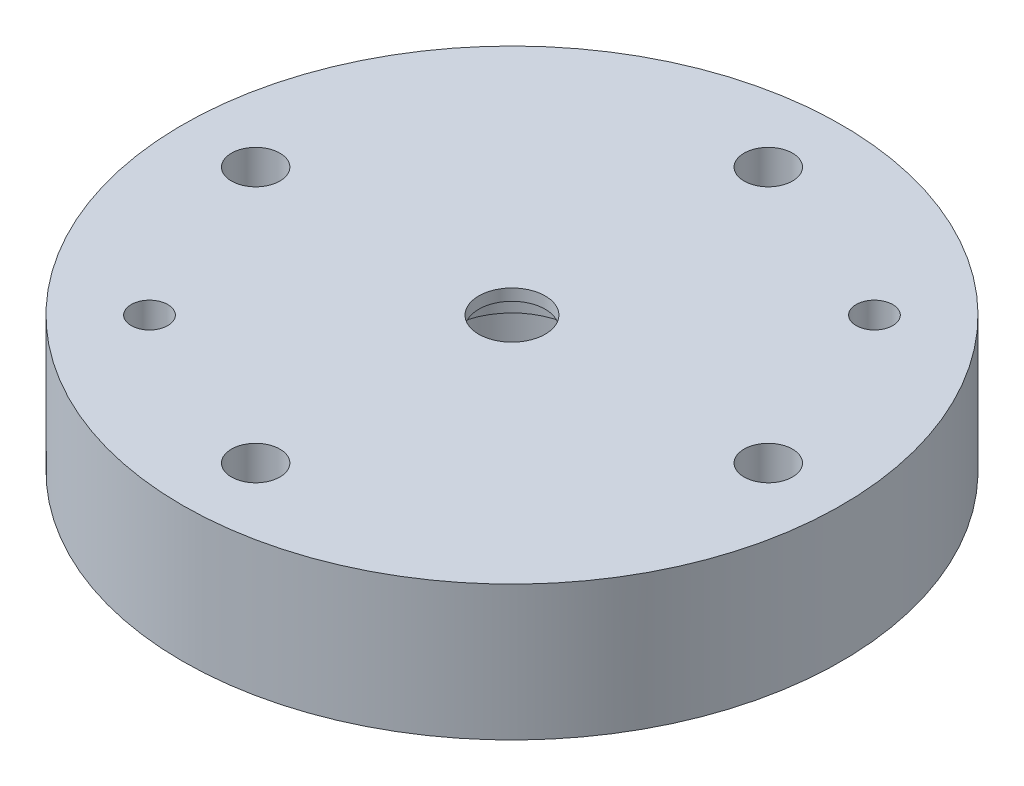
from build123d import *

# Parameters (mm, degrees)
SKETCH1_R                      = 57.15
SEAL_SEAT_HIEGHT_DEPTH         = 5.5372
SKETCH2_R                      = 57.15
SEAL_DIAPHRAM_HIEGHT_DEPTH     = 15.875
SEAL_START                     = 2
SKETCH3_R                      = 57.15
SEAL_SHOULDER_HIEGHT_DEPTH     = 2
SKETCH5_R                      = 11.1125
SEAL_SEAT_FIT_DEPTH            = 5.5372
SKETCH7_R                      = 5.7625
SHAFT_CLEARANCE_DEPTH          = 2
M8_CLEARANCE_HOLE1_D           = 8.4
F_1_4_0_25_PRESS_DOWEL_HOLE1_D = 6.35
SKETCH6_R                      = 12.7
CUT_EXTRUDE1_DEPTH             = 15.875


with BuildPart() as part:
    # Sketch1 → seal seat hieght (new body)
    with BuildSketch(Plane(origin=(0, 0, 0), x_dir=(1, 0, 0), z_dir=(0, 1, 0))):
        with Locations(Location((0, 0, 0), (0, 0, 270))):
            Circle(SKETCH1_R)
    extrude(amount=-SEAL_SEAT_HIEGHT_DEPTH)

    # Sketch2 → seal diaphram hieght (add)
    with BuildSketch(Plane.XZ.offset(5.5372)):
        with Locations(Location((0, 0, 0), (0, 0, 90))):
            Circle(SKETCH2_R)
    extrude(amount=SEAL_DIAPHRAM_HIEGHT_DEPTH)

    # Sketch3 → seal shoulder hieght (add)
    with BuildSketch(Plane(origin=(0, 0, 0), x_dir=(1, 0, 0), z_dir=(0, 1, 0)).offset(SEAL_START)):
        with Locations(Location((0, 0, 0), (0, 0, 270))):
            Circle(SKETCH3_R)
    extrude(amount=-SEAL_SHOULDER_HIEGHT_DEPTH)

    # Sketch5 → seal seat fit (cut)
    with BuildSketch(Plane(origin=(0, 0, 0), x_dir=(1, 0, 0), z_dir=(0, 1, 0))):
        with Locations(Location((0, 0, 0), (0, 0, 270))):
            Circle(SKETCH5_R)
    extrude(amount=-SEAL_SEAT_FIT_DEPTH, mode=Mode.SUBTRACT)

    # Sketch7 → shaft clearance (cut)
    with BuildSketch(Plane(origin=(0, 0, 0), x_dir=(1, 0, 0), z_dir=(0, 1, 0))):
        with Locations(Location((0, 0, 0), (0, 0, 270))):
            Circle(SKETCH7_R)
    extrude(amount=SHAFT_CLEARANCE_DEPTH, mode=Mode.SUBTRACT)

    # M8 Clearance Hole1 (through all)
    with Locations(Plane(origin=(0, 2, 0), x_dir=(1, 0, 0), z_dir=(0, 1, 0))):
        with Locations((-44.45, 0), (0, 44.45), (44.45, 0), (0, -44.45)):
            Hole(M8_CLEARANCE_HOLE1_D / 2)

    # 1/4 (0.25) Press Dowel Hole1 (through all)
    with Locations(Plane(origin=(0, 2, 0), x_dir=(1, 0, 0), z_dir=(0, 1, 0))):
        with Locations((31.430896424, 31.430896424), (-31.430896424, -31.430896424)):
            Hole(F_1_4_0_25_PRESS_DOWEL_HOLE1_D / 2)

    # Sketch6 → Cut-Extrude1 (cut)
    with BuildSketch(Plane(origin=(0, -21.4122, 0), x_dir=(-1, 0, 0), z_dir=(0, -1, 0))):
        with Locations(Location((0, 0, 0), (0, 0, 90))):
            Circle(SKETCH6_R)
    extrude(amount=-CUT_EXTRUDE1_DEPTH, mode=Mode.SUBTRACT)


solid = part.part
